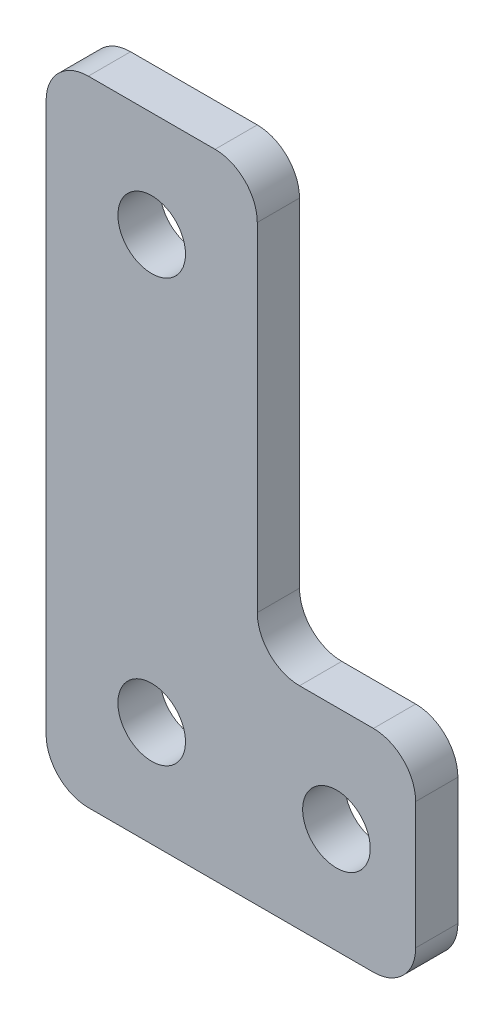
from build123d import *

# Parameters (mm, degrees)
SKETCH_1_R      = 1.6
EXTRUDE_1_DEPTH = 2
FILLET_2_R      = 2


with BuildPart() as part:
    # ｽｹｯﾁ1 → ﾎﾞｽ - 押し出し1 (new body)
    with BuildSketch(Plane.XY):
        Polygon((0, 0), (10, 0), (17.5, 0), (17.5, 10), (10, 10), (10, 30), (0, 30), align=None)
        with Locations((5, 25)):
            Circle(SKETCH_1_R, mode=Mode.SUBTRACT)
        with Locations(Location((5, 5, 0), (0, 0, 180))):
            Circle(SKETCH_1_R, mode=Mode.SUBTRACT)
        with Locations((13.75, 5)):
            Circle(SKETCH_1_R, mode=Mode.SUBTRACT)
    extrude(amount=EXTRUDE_1_DEPTH)

    # ﾌｨﾚｯﾄ2
    fillet_2_edges = [part.edges().sort_by_distance(p)[0] for p in [
        (0, 30, 1),
        (10, 30, 1),
        (10, 10, 1),
        (17.5, 10, 1),
        (17.5, 0, 1),
        (0, 0, 1),
    ]]
    fillet(fillet_2_edges, radius=FILLET_2_R)


solid = part.part
